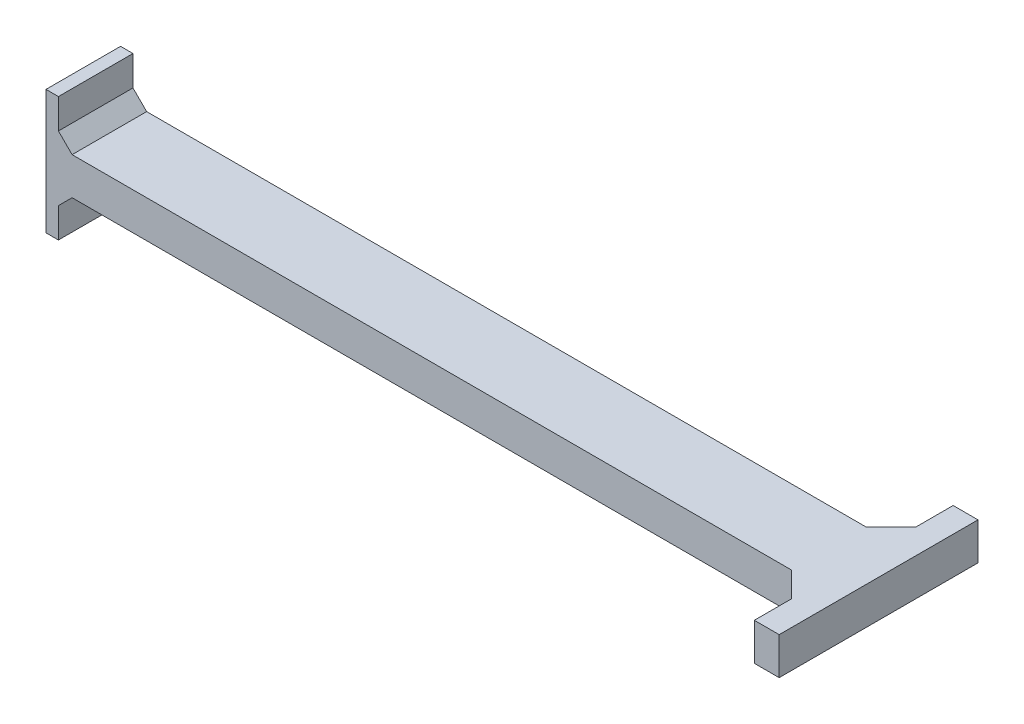
from build123d import *

# Parameters (mm, degrees)
BOSS_EXTRUDE1_DEPTH = 38.1
BOSS_EXTRUDE2_DEPTH = 19.05


with BuildPart() as part:
    # Sketch3 → Boss-Extrude1 (new body)
    with BuildSketch(Plane.XY):
        Polygon((0, 0), (0, 19.05), (-367.665, 19.05), (-374.65, 26.035), (-374.65, 41.275), (-381, 41.275), (-381, -22.225), (-374.65, -22.225), (-374.65, -6.985), (-367.665, 0), align=None)
    extrude(amount=BOSS_EXTRUDE1_DEPTH)

    # Sketch4 → Boss-Extrude2 (add)
    with BuildSketch(Plane(origin=(0, 19.05, 0), x_dir=(1, 0, 0), z_dir=(0, 1, 0))):
        Polygon((0, 0), (12.7, 12.7), (12.7, 31.75), (25.4, 31.75), (25.4, -69.85), (12.7, -69.85), (12.7, -50.8), (0, -38.1), align=None)
    extrude(amount=-BOSS_EXTRUDE2_DEPTH)


solid = part.part
